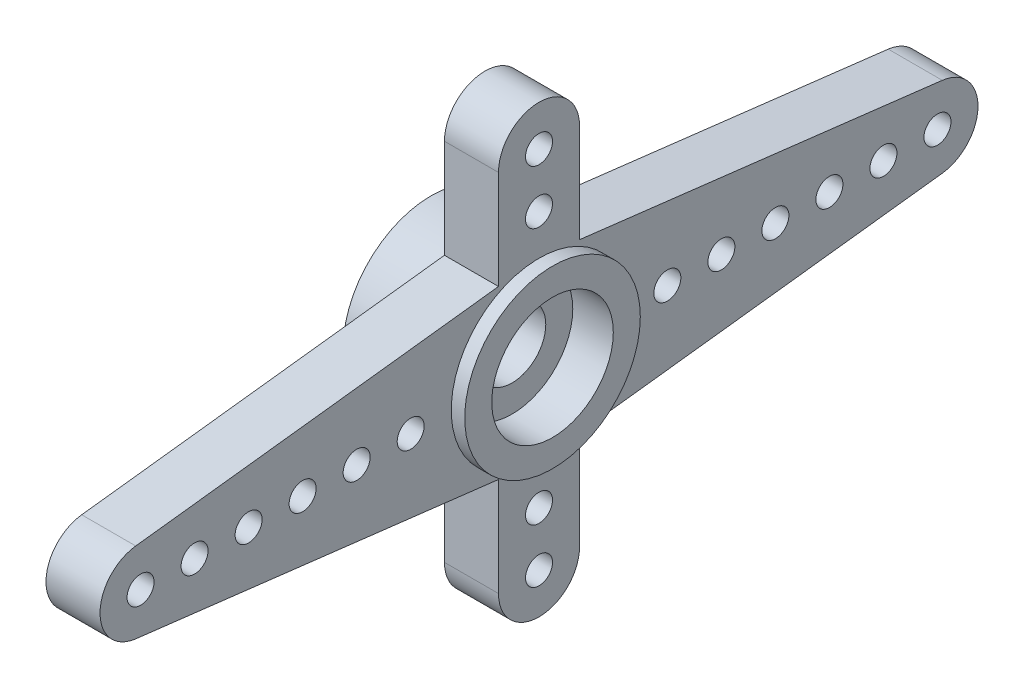
from build123d import *

# Parameters (mm, degrees)
SKETCH_1_R          = 3.25
SKETCH_1_R_2        = 0.5
EXTRUDE_1_DEPTH     = 2
EXTRUDE_START       = -2
SKETCH_2_R          = 3.25
SKETCH_2_R_2        = 1.25
EXTRUDE_2_DEPTH     = 2
SKETCH_3_R          = 3.25
SKETCH_3_R_2        = 2.25
EXTRUDE_3_DEPTH     = 2
EXTRUDE_START_2     = 0.5
SKETCH_4_R          = 3.25
SKETCH_4_R_2        = 2.25
EXTRUDE_5_DEPTH     = 0.5
SKETCH_5_R          = 2.25
SKETCH_5_R_2        = 1.25
CUT_EXTRUDE_1_DEPTH = 1


with BuildPart() as part:
    # 草图1 → 凸台-拉伸1 (new body)
    with BuildSketch(Plane(origin=(0, 0, 0), x_dir=(0, 0, -1), z_dir=(1, 0, 0))):
        with BuildLine():
            Line((-14.927966102, 1.489405273), (-1.5, 3.093886487))
            Line((-1.5, 3.093886487), (-1.5, 6.75))
            ThreePointArc((-1.5, 6.75), (0, 8.25), (1.5, 6.75))
            Line((1.5, 6.75), (1.5, 3.093886487))
            Line((1.5, 3.093886487), (14.927966102, 1.489405273))
            ThreePointArc((14.927966102, 1.489405273), (16.25, 0), (14.927966102, -1.489405273))
            Line((14.927966102, -1.489405273), (1.5, -3.093886487))
            Line((1.5, -3.093886487), (1.5, -6.75))
            ThreePointArc((1.5, -6.75), (0, -8.25), (-1.5, -6.75))
            Line((-1.5, -6.75), (-1.5, -3.093886487))
            Line((-1.5, -3.093886487), (-14.927966102, -1.489405273))
            ThreePointArc((-14.927966102, -1.489405273), (-16.25, 0), (-14.927966102, 1.489405273))
        make_face()
        Circle(SKETCH_1_R, mode=Mode.SUBTRACT)
        with Locations((4.75, 0)):
            Circle(SKETCH_1_R_2, mode=Mode.SUBTRACT)
        with Locations((6.75, 0)):
            Circle(SKETCH_1_R_2, mode=Mode.SUBTRACT)
        with Locations((8.75, 0)):
            Circle(SKETCH_1_R_2, mode=Mode.SUBTRACT)
        with Locations((10.75, 0)):
            Circle(SKETCH_1_R_2, mode=Mode.SUBTRACT)
        with Locations((12.75, 0)):
            Circle(SKETCH_1_R_2, mode=Mode.SUBTRACT)
        with Locations((14.75, 0)):
            Circle(SKETCH_1_R_2, mode=Mode.SUBTRACT)
        with Locations(Location((-14.75, 0, 0), (0, 0, 180))):
            Circle(SKETCH_1_R_2, mode=Mode.SUBTRACT)
        with Locations(Location((-12.75, 0, 0), (0, 0, 180))):
            Circle(SKETCH_1_R_2, mode=Mode.SUBTRACT)
        with Locations(Location((-10.75, 0, 0), (0, 0, 180))):
            Circle(SKETCH_1_R_2, mode=Mode.SUBTRACT)
        with Locations(Location((-8.75, 0, 0), (0, 0, 180))):
            Circle(SKETCH_1_R_2, mode=Mode.SUBTRACT)
        with Locations(Location((-6.75, 0, 0), (0, 0, 180))):
            Circle(SKETCH_1_R_2, mode=Mode.SUBTRACT)
        with Locations(Location((-4.75, 0, 0), (0, 0, 180))):
            Circle(SKETCH_1_R_2, mode=Mode.SUBTRACT)
        with Locations((0, 4.75)):
            Circle(SKETCH_1_R_2, mode=Mode.SUBTRACT)
        with Locations((0, 6.75)):
            Circle(SKETCH_1_R_2, mode=Mode.SUBTRACT)
        with Locations(Location((0, -4.75, 0), (0, 0, 180))):
            Circle(SKETCH_1_R_2, mode=Mode.SUBTRACT)
        with Locations(Location((0, -6.75, 0), (0, 0, 180))):
            Circle(SKETCH_1_R_2, mode=Mode.SUBTRACT)
    extrude(amount=EXTRUDE_1_DEPTH)

    # 草图2 → 凸台-拉伸2 (add)
    with BuildSketch(Plane(origin=(2, 0, 0), x_dir=(0, 0, -1), z_dir=(1, 0, 0)).offset(EXTRUDE_START)):
        Circle(SKETCH_2_R)
        Circle(SKETCH_2_R_2, mode=Mode.SUBTRACT)
    extrude(amount=EXTRUDE_2_DEPTH)

    # 草图3 → 凸台-拉伸3 (add)
    with BuildSketch(Plane.ZY):
        with Locations(Location((0, 0, 0), (0, 0, 180))):
            Circle(SKETCH_3_R)
        Circle(SKETCH_3_R_2, mode=Mode.SUBTRACT)
    extrude(amount=EXTRUDE_3_DEPTH)

    # 草图4 → 凸台-拉伸5 (add)
    with BuildSketch(Plane(origin=(2, 0, 0), x_dir=(0, 0, -1), z_dir=(1, 0, 0)).offset(EXTRUDE_START_2)):
        Circle(SKETCH_4_R)
        with Locations(Location((0, 0, 0), (0, 0, 180))):
            Circle(SKETCH_4_R_2, mode=Mode.SUBTRACT)
    extrude(amount=-EXTRUDE_5_DEPTH)

    # 草图5 → 切除-拉伸1 (cut)
    with BuildSketch(Plane(origin=(2, 0, 0), x_dir=(0, 0, -1), z_dir=(1, 0, 0))):
        with Locations(Location((0, 0, 0), (0, 0, 180))):
            Circle(SKETCH_5_R)
        Circle(SKETCH_5_R_2, mode=Mode.SUBTRACT)
    extrude(amount=-CUT_EXTRUDE_1_DEPTH, mode=Mode.SUBTRACT)


solid = part.part
